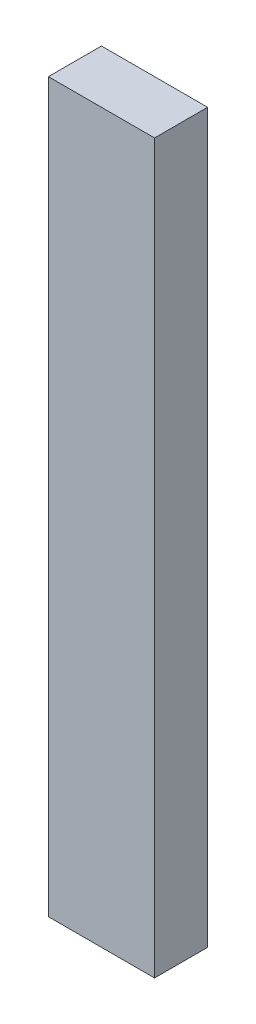
from build123d import *

# Parameters (mm, degrees)
SKETCH1_W           = 609.6
SKETCH1_H           = 304.8
BOSS_EXTRUDE1_DEPTH = 4178.3


with BuildPart() as part:
    # Sketch1 → Boss-Extrude1 (new body)
    with BuildSketch(Plane(origin=(0, 0, 0), x_dir=(1, 0, 0), z_dir=(0, 1, 0))):
        Rectangle(SKETCH1_W, SKETCH1_H)
    extrude(amount=BOSS_EXTRUDE1_DEPTH)


solid = part.part
